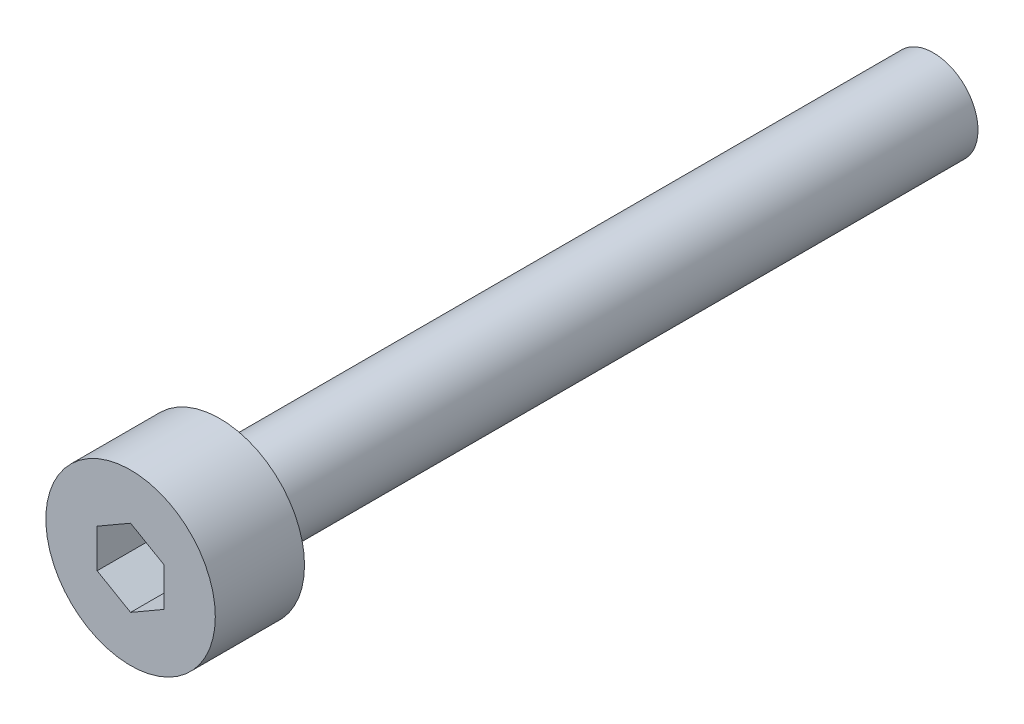
from build123d import *

# Parameters (mm, degrees)
M2_SCREW_SHANK_PROFILE_R  = 1
M2_SCREW_SHANK_DEPTH      = 16
SOCKET_CAP_HEAD_PROFILE_R = 1.9
SOCKET_CAP_HEAD_DEPTH     = 2
CUT_HEX_KEY_RECESS_DEPTH  = 1.2


with BuildPart() as part:
    # M2 screw shank profile → M2 screw shank (new body)
    with BuildSketch(Plane.XY.offset(3.2)):
        with Locations((-63.291651246, -5.5)):
            Circle(M2_SCREW_SHANK_PROFILE_R)
    extrude(amount=M2_SCREW_SHANK_DEPTH)

    # Socket cap head profile → Socket cap head (add)
    with BuildSketch(Plane.XY.offset(19.2)):
        with Locations((-63.291651246, -5.5)):
            Circle(SOCKET_CAP_HEAD_PROFILE_R)
    extrude(amount=SOCKET_CAP_HEAD_DEPTH)

    # Hex key socket → Cut hex key recess (cut)
    with BuildSketch(Plane.XY.offset(20.1)):
        Polygon((-62.541651246, -5.066987298), (-63.291651246, -4.633974596), (-64.041651246, -5.066987298), (-64.041651246, -5.933012702), (-63.291651246, -6.366025404), (-62.541651246, -5.933012702), align=None)
    extrude(amount=CUT_HEX_KEY_RECESS_DEPTH, mode=Mode.SUBTRACT)


solid = part.part
